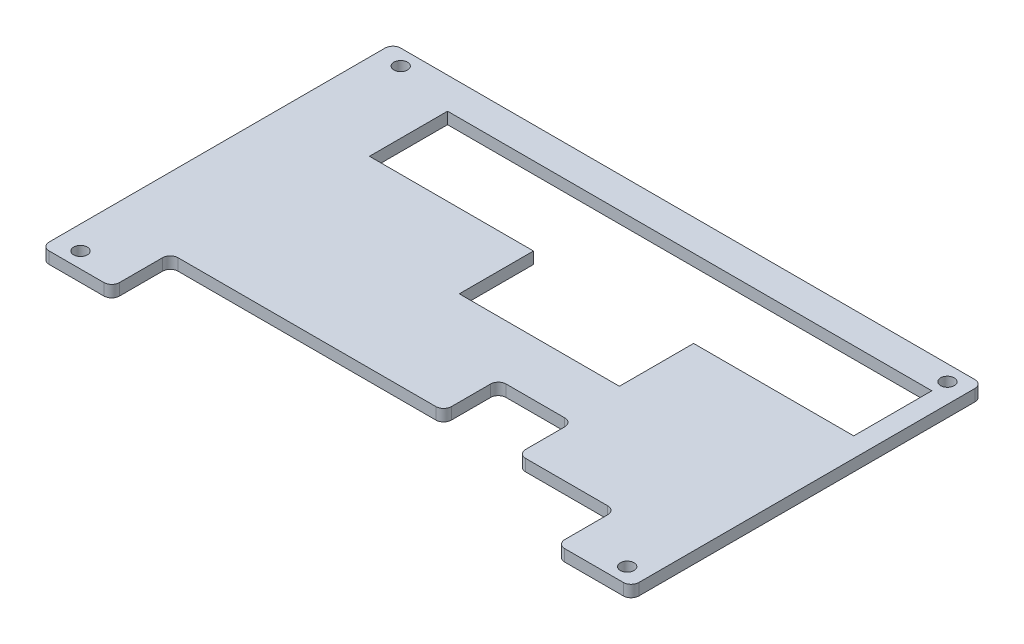
from build123d import *

# Parameters (mm, degrees)
SKETCH1_W           = 151
SKETCH1_H           = 90
BOSS_EXTRUDE1_DEPTH = 3
SKETCH2_R           = 1.75
CUT_EXTRUDE1_DEPTH  = 176.812400018
FILLET1_R           = 2
CUT_EXTRUDE2_DEPTH  = 176.812400018
FILLET2_R           = 2


with BuildPart() as part:
    # Sketch1 → Boss-Extrude1 (new body)
    with BuildSketch(Plane(origin=(0, 0, 0), x_dir=(1, 0, 0), z_dir=(0, 1, 0))):
        with Locations((75.5, 45)):
            Rectangle(SKETCH1_W, SKETCH1_H)
    extrude(amount=BOSS_EXTRUDE1_DEPTH)

    # Sketch2 → Cut-Extrude1 (cut, through all)
    with BuildSketch(Plane(origin=(0, 3, 0), x_dir=(1, 0, 0), z_dir=(0, 1, 0))):
        with Locations(Location((146, 86, 0), (0, 0, 270))):
            Circle(SKETCH2_R)
        with Locations(Location((146, 4, 0), (0, 0, 270))):
            Circle(SKETCH2_R)
        with Locations(Location((6, 86, 0), (0, 0, 270))):
            Circle(SKETCH2_R)
        with Locations(Location((6, 4, 0), (0, 0, 270))):
            Circle(SKETCH2_R)
    extrude(amount=-CUT_EXTRUDE1_DEPTH, mode=Mode.SUBTRACT)

    # Fillet1
    fillet1_edges = [part.edges().sort_by_distance(p)[0] for p in [
        (0, 1.5, -90),
        (151, 1.5, -90),
        (151, 1.5, 0),
        (0, 1.5, 0),
    ]]
    fillet(fillet1_edges, radius=FILLET1_R)

    # Sketch3 → Cut-Extrude2 (cut, through all)
    with BuildSketch(Plane(origin=(0, 3, 0), x_dir=(1, 0, 0), z_dir=(0, 1, 0))):
        Polygon((105, 62), (146, 62), (146, 82), (22, 82), (22, 62), (64, 62), (64, 43), (105, 43), align=None)
        Polygon((18, 0), (132, 0), (132, 15), (107, 15), (107, 29), (88, 29), (88, 15), (18, 15), align=None)
    extrude(amount=-CUT_EXTRUDE2_DEPTH, mode=Mode.SUBTRACT)

    # Fillet2
    fillet2_edges = [part.edges().sort_by_distance(p)[0] for p in [
        (18, 1.5, 0),
        (18, 1.5, -15),
        (88, 1.5, -15),
        (88, 1.5, -29),
        (107, 1.5, -29),
        (107, 1.5, -15),
        (132, 1.5, -15),
        (132, 1.5, 0),
    ]]
    fillet(fillet2_edges, radius=FILLET2_R)


solid = part.part
